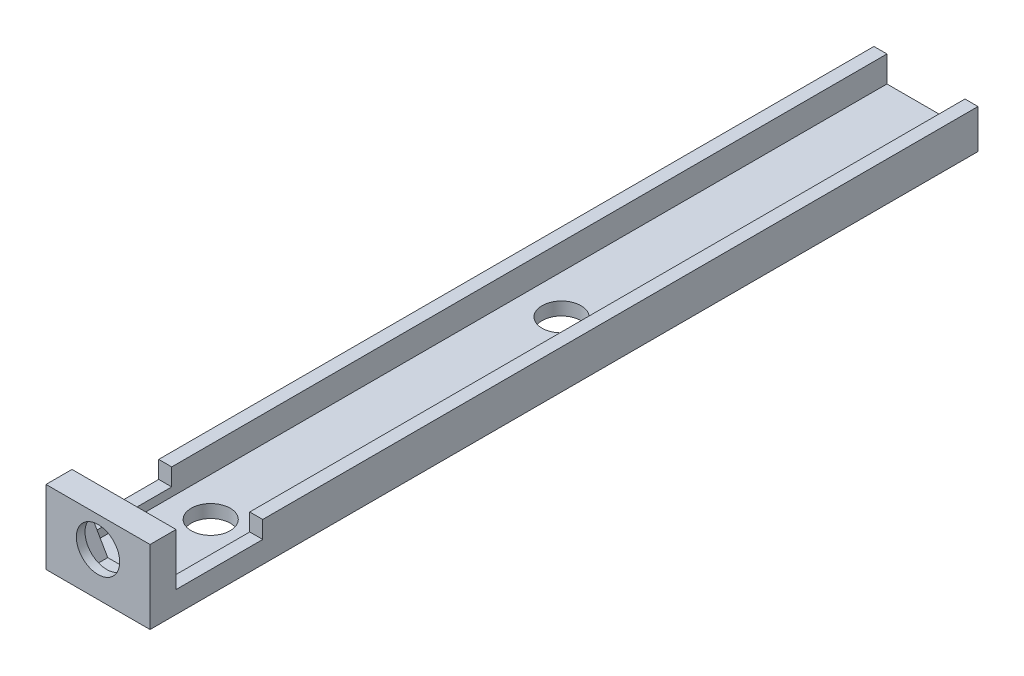
from build123d import *

# Parameters (mm, degrees)
BOSS_EXTRUDE1_DEPTH = 165
BOSS_EXTRUDE2_DEPTH = 24
BOSS_EXTRUDE3_DEPTH = 4
SKETCH3_3_W         = 24
SKETCH3_3_H         = 17
SKETCH3_3_R         = 5
BOSS_EXTRUDE4_DEPTH = 2
SKETCH4_R           = 4.5
CUT_EXTRUDE1_DEPTH  = 194.010362416


with BuildPart() as part:
    # Sketch1 → Boss-Extrude1 (new body)
    with BuildSketch(Plane.XY):
        Polygon((0, 0), (0, 9), (3, 9), (3, 3), (21, 3), (21, 9), (24, 9), (24, 0), align=None)
    extrude(amount=BOSS_EXTRUDE1_DEPTH)

    # Sketch2 → Boss-Extrude2 (add)
    with BuildSketch(Plane.XY.offset(165)):
        Polygon((0, 0), (24, 0), (24, 5), (21, 5), (21, 3), (3, 3), (3, 5), (0, 5), align=None)
    extrude(amount=BOSS_EXTRUDE2_DEPTH)

    # Sketch3 → Boss-Extrude3 (add)
    with BuildSketch(Plane.XY.offset(189)):
        Polygon((0, 17), (0, 5), (3, 5), (3, 3), (21, 3), (21, 5), (24, 5), (24, 17), align=None)
        Polygon((8.24722325, 16.5), (15.75277675, 16.5), (19.505553499, 10), (15.75277675, 3.5), (8.24722325, 3.5), (4.494446501, 10), align=None, mode=Mode.SUBTRACT)
    extrude(amount=-BOSS_EXTRUDE3_DEPTH)

    # Sketch3<3> → Boss-Extrude4 (add)
    with BuildSketch(Plane.XY.offset(189)):
        with Locations((12, 8.5)):
            Rectangle(SKETCH3_3_W, SKETCH3_3_H)
        with Locations((12, 10)):
            Circle(SKETCH3_3_R, mode=Mode.SUBTRACT)
    extrude(amount=BOSS_EXTRUDE4_DEPTH)

    # Sketch4 → Cut-Extrude1 (cut, through all)
    with BuildSketch(Plane(origin=(0, 3, 0), x_dir=(1, 0, 0), z_dir=(0, 1, 0))):
        with Locations((12, -165)):
            Circle(SKETCH4_R)
        with Locations((12, -84.075)):
            Circle(SKETCH4_R)
    extrude(amount=-CUT_EXTRUDE1_DEPTH, mode=Mode.SUBTRACT)


solid = part.part
